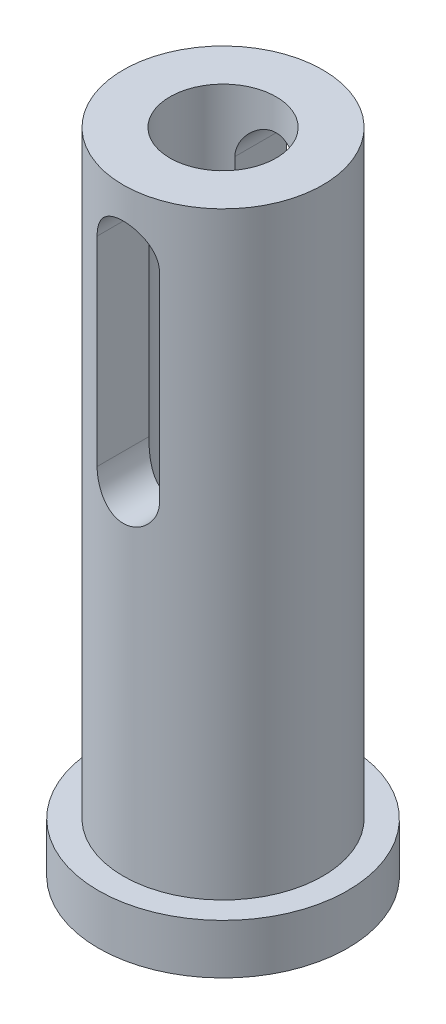
from build123d import *

# Parameters (mm, degrees)
SKETCH1_R                 = 3.175
BOSS_EXTRUDE1_DEPTH       = 1.27
SKETCH2_R                 = 2.54
BOSS_EXTRUDE2_DEPTH       = 15.24
TAP_DRILL_FOR_6_32_TAP1_D = 2.7051
CUT_EXTRUDE1_DEPTH        = 18.109685853
CUT_EXTRUDE1_DEPTH_BACK   = 18.109685853


with BuildPart() as part:
    # Sketch1 → Boss-Extrude1 (new body)
    with BuildSketch(Plane(origin=(0, 0, 0), x_dir=(1, 0, 0), z_dir=(0, 1, 0))):
        with Locations(Location((0, 0, 0), (0, 0, 270))):
            Circle(SKETCH1_R)
    extrude(amount=BOSS_EXTRUDE1_DEPTH)

    # Sketch2 → Boss-Extrude2 (add)
    with BuildSketch(Plane(origin=(0, 1.27, 0), x_dir=(1, 0, 0), z_dir=(0, 1, 0))):
        with Locations(Location((0, 0, 0), (0, 0, 90))):
            Circle(SKETCH2_R)
    extrude(amount=BOSS_EXTRUDE2_DEPTH)

    # Tap Drill for #6-32 Tap1 (through all)
    with Locations(Plane(origin=(0, 16.51, 0), x_dir=(1, 0, 0), z_dir=(0, 1, 0))):
        with Locations((0, 0)):
            Hole(TAP_DRILL_FOR_6_32_TAP1_D / 2)

    # Sketch6 → Cut-Extrude1 (cut, two sides: drawn at the far end of the back side and taken through both)
    with BuildSketch(Plane.XY.offset(-CUT_EXTRUDE1_DEPTH_BACK)):
        with BuildLine():
            Line((0.79375, 14.9225), (0.79375, 9.8425))
            ThreePointArc((0.79375, 9.8425), (0, 9.04875), (-0.79375, 9.8425))
            Line((-0.79375, 9.8425), (-0.79375, 14.9225))
            ThreePointArc((-0.79375, 14.9225), (0, 15.71625), (0.79375, 14.9225))
        make_face()
    extrude(amount=CUT_EXTRUDE1_DEPTH + CUT_EXTRUDE1_DEPTH_BACK, mode=Mode.SUBTRACT)


solid = part.part
